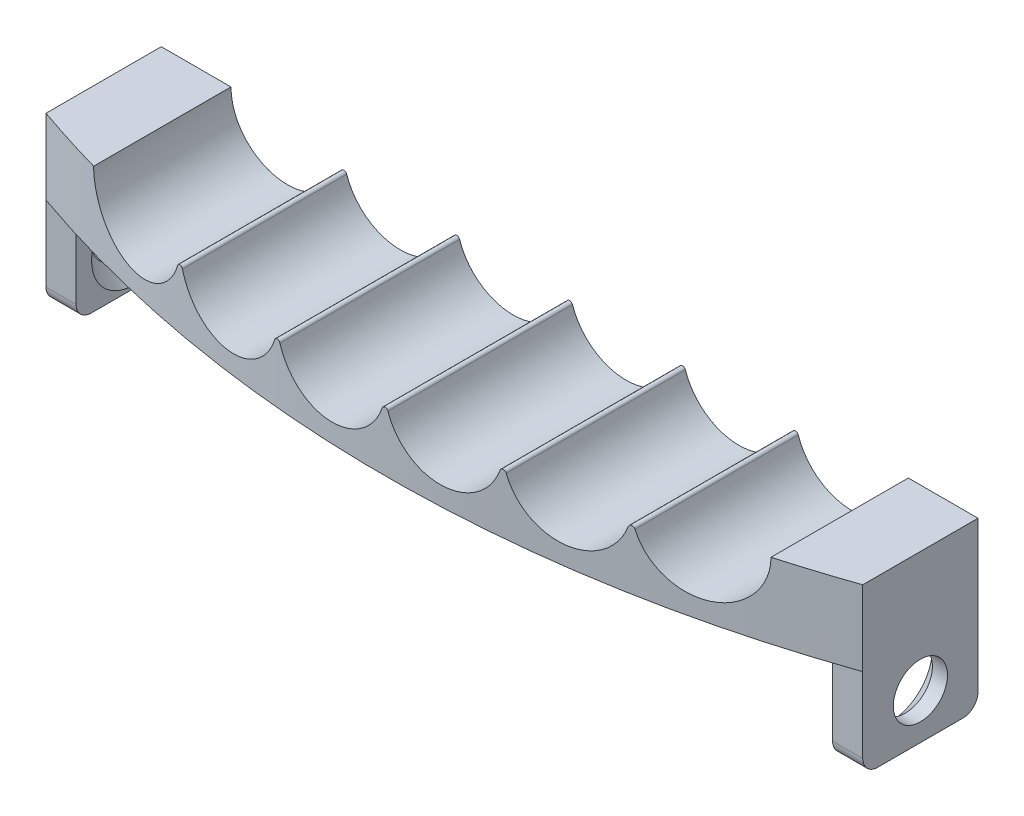
from build123d import *

# Parameters (mm, degrees)
RESSALTO_EXTRUS_O2_DEPTH = 12.26
CORTE_EXTRUS_O1_DEPTH    = 12.26
FILETE1_R                = 0.2
ESBO_O4_W                = 7.65739308
ESBO_O4_H                = 6
ESBO_O4_R                = 1.8
RESSALTO_EXTRUS_O3_DEPTH = 2
FILETE2_R                = 1
CHANFRO1_SIZE            = 1


with BuildPart() as part:
    # Esboço2 → Ressalto-extrusão2 (new body)
    with BuildSketch(Plane.XY):
        with BuildLine():
            Line((-22.5, 0), (-27.13, 0))
            Line((-27.13, 0), (-27.13, -5))
            Line((-27.13, -5), (27.13, -5))
            Line((27.13, -5), (27.13, 0))
            Line((27.13, 0), (22.5, 0))
            ThreePointArc((22.5, 0), (18.75, -3.75), (15, 0))
            ThreePointArc((15, 0), (11.25, -3.75), (7.5, 0))
            ThreePointArc((7.5, 0), (3.75, -3.75), (0, 0))
            ThreePointArc((0, 0), (-3.75, -3.75), (-7.5, 0))
            ThreePointArc((-7.5, 0), (-11.25, -3.75), (-15, 0))
            ThreePointArc((-15, 0), (-18.75, -3.75), (-22.5, 0))
        make_face()
    extrude(amount=RESSALTO_EXTRUS_O2_DEPTH)

    # Esboço3 → Corte-extrusão1 (cut)
    with BuildSketch(Plane(origin=(0, 0, 0), x_dir=(1, 0, 0), z_dir=(0, 1, 0))):
        with BuildLine():
            ThreePointArc((-22.5, -9.123053531), (-24.825818519, -8.424398849), (-27.13, -7.65739308))
            Line((-27.13, -7.65739308), (-27.13, -12.26))
            Line((-27.13, -12.26), (-22.5, -12.26))
            Line((-22.5, -12.26), (-22.5, -9.123053531))
        make_face()
        with BuildLine():
            ThreePointArc((-3.28e-07, -12.26), (-11.358812085, -11.471988978), (-22.5, -9.123053531))
            Line((-22.5, -9.123053531), (-22.5, -12.26))
            Line((-22.5, -12.26), (-3.28e-07, -12.26))
        make_face()
        with BuildLine():
            ThreePointArc((27.13, -7.65739308), (13.758823284, -11.101186069), (-3.28e-07, -12.26))
            Line((-3.28e-07, -12.26), (27.13, -12.26))
            Line((27.13, -12.26), (27.13, -7.65739308))
        make_face()
    extrude(amount=-CORTE_EXTRUS_O1_DEPTH, mode=Mode.SUBTRACT)

    # Filete1
    filete1_edges = [part.edges().sort_by_distance(p)[0] for p in [
        (15, 0, 5.440411719),
        (7.5, 0, 5.958691385),
        (0, 0, 6.13),
        (-7.5, 0, 5.958691385),
        (-15, 0, 5.440411719),
    ]]
    fillet(filete1_edges, radius=FILETE1_R)

    # Esboço4 → Ressalto-extrusão3 (add)
    with BuildSketch(Plane(origin=(27.13, 0, 0), x_dir=(0, 0, -1), z_dir=(1, 0, 0))):
        with Locations((-3.82869654, -8)):
            Rectangle(ESBO_O4_W, ESBO_O4_H)
        with Locations((-3.82869654, -8)):
            Circle(ESBO_O4_R, mode=Mode.SUBTRACT)
    ressalto_extrus_o3 = extrude(amount=-RESSALTO_EXTRUS_O3_DEPTH)

    # Espelhar1: Ressalto-extrusão3 across plane
    add(ressalto_extrus_o3.mirror(Plane(origin=(0, 0, 0), x_dir=(0, 0, 1), z_dir=(1, 0, 0))))

    # Filete2
    filete2_edges = [part.edges().sort_by_distance(p)[0] for p in [
        (26.13, -11, 7.65739308),
        (26.13, -11, 0),
        (-26.13, -11, 7.65739308),
        (-26.13, -11, 0),
    ]]
    fillet(filete2_edges, radius=FILETE2_R)

    # Chanfro1
    chanfro1_edges = [part.edges().sort_by_distance(p)[0] for p in [
        (25.13, -8, 5.62869654),
        (-25.13, -8, 5.62869654),
    ]]
    chamfer(chanfro1_edges, length=CHANFRO1_SIZE)


solid = part.part
